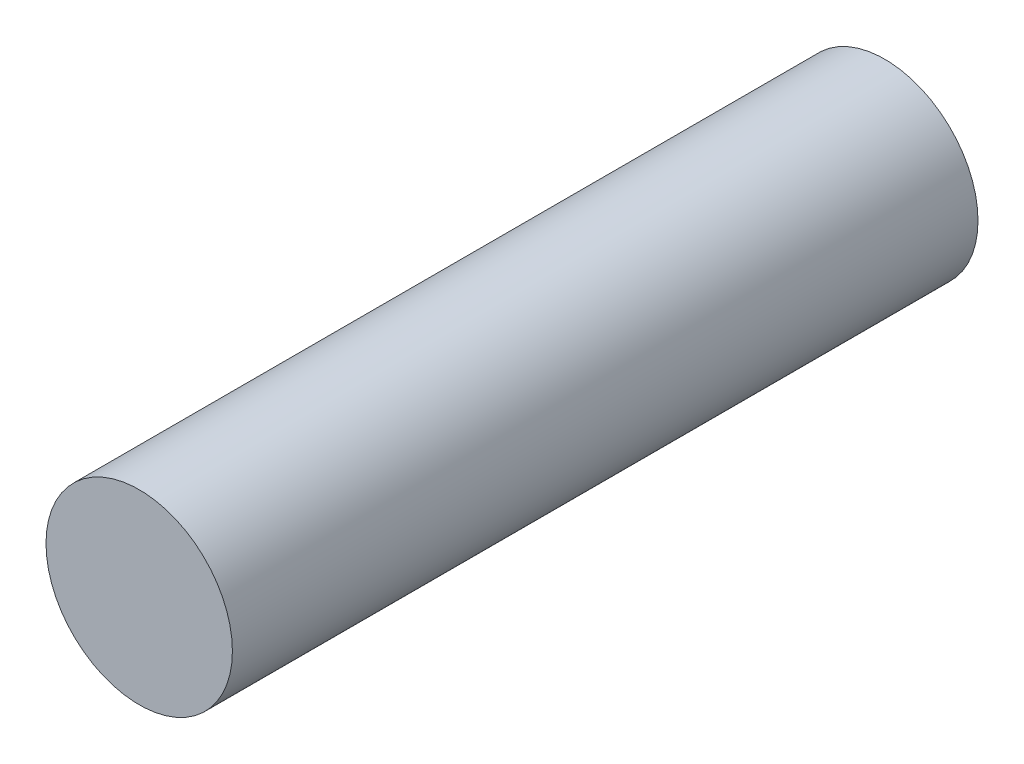
from build123d import *

# Parameters (mm, degrees)
SKETCH1_R      = 3.175
EXTRUDE1_DEPTH = 25.4


with BuildPart() as part:
    # Sketch1 → Extrude1 (new body)
    with BuildSketch(Plane.XY):
        Circle(SKETCH1_R)
    extrude(amount=EXTRUDE1_DEPTH)


solid = part.part
